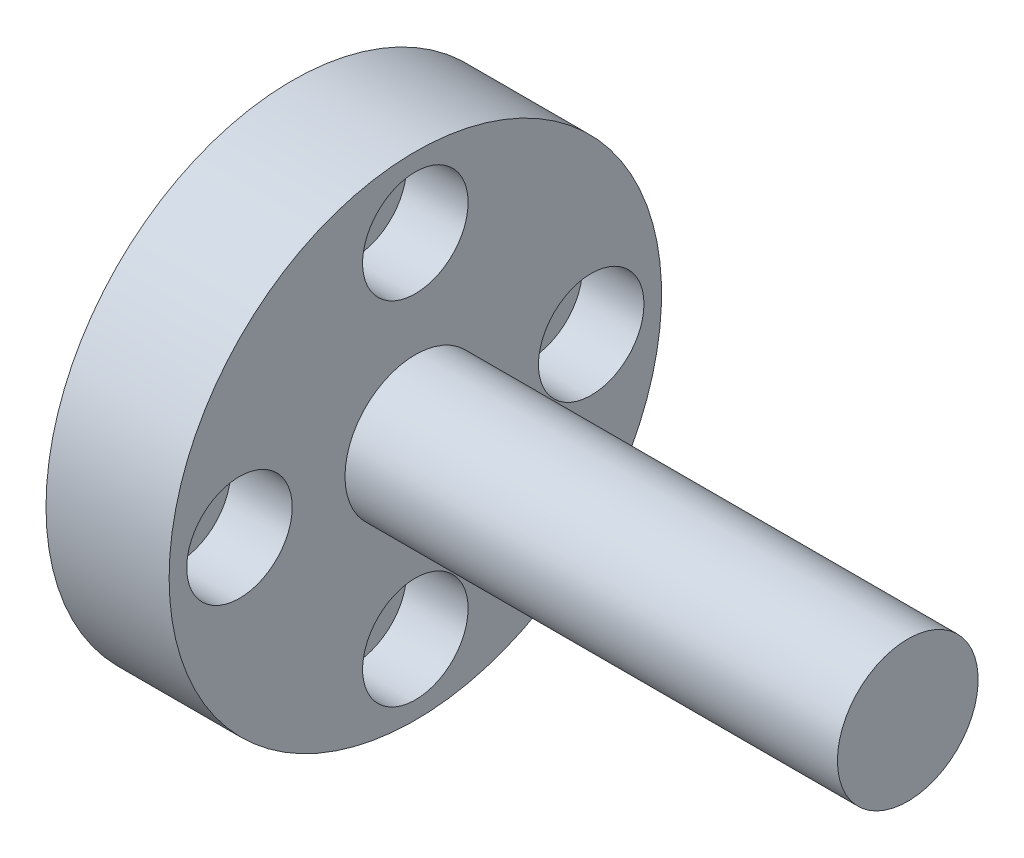
from build123d import *

# Parameters (mm, degrees)
CBORE_FOR_M3_SBHCS1_D           = 3.2
CBORE_FOR_M3_SBHCS1_CBORE_D     = 6
CBORE_FOR_M3_SBHCS1_CBORE_DEPTH = 3.5
CIRPATTERN1_COUNT               = 4
SKETCH5_R                       = 2.5
CUT_EXTRUDE1_DEPTH              = 2


with BuildPart() as part:
    # Sketch2 → Revolve2 (revolve)
    with BuildSketch(Plane.XY, mode=Mode.PRIVATE) as revolve2_sk:
        Polygon((0, 14), (0, 0), (35, 0), (35, 4), (7, 4), (7, 14), align=None)
    revolve(revolve2_sk.sketch.rotate(Axis((0, 0, 0), (1, 0, 0)), 90), axis=Axis((0, 0, 0), (1, 0, 0)))

    # CBORE for M3 SBHCS1 (through all)
    with Locations(Plane(origin=(7, 0, 0), x_dir=(0, 0, -1), z_dir=(1, 0, 0))):
        with Locations((10, 0)):
            cbore_for_m3_sbhcs1 = CounterBoreHole(CBORE_FOR_M3_SBHCS1_D / 2, CBORE_FOR_M3_SBHCS1_CBORE_D / 2, CBORE_FOR_M3_SBHCS1_CBORE_DEPTH)

    # CirPattern1: CBORE for M3 SBHCS1 ×4 about axis
    cirpattern1_axis = Axis((0, 0, 0), (1, 0, 0))
    for i in range(1, CIRPATTERN1_COUNT):
        add(cbore_for_m3_sbhcs1.rotate(cirpattern1_axis, i * 360 / CIRPATTERN1_COUNT), mode=Mode.SUBTRACT)

    # Sketch5 → Cut-Extrude1 (cut)
    with BuildSketch(Plane.ZY):
        Circle(SKETCH5_R)
    extrude(amount=-CUT_EXTRUDE1_DEPTH, mode=Mode.SUBTRACT)


solid = part.part
